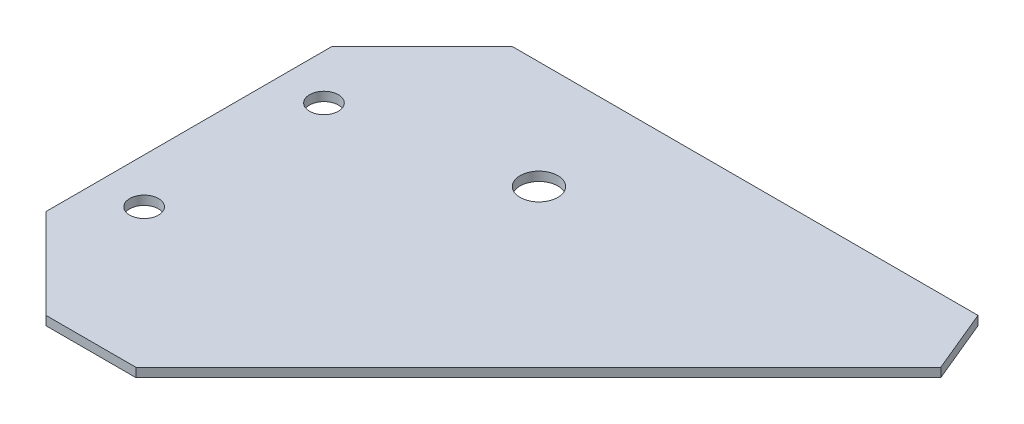
from build123d import *

# Parameters (mm, degrees)
SKETCH_1_W          = 80
SKETCH_1_H          = 31.819805153
SKETCH_1_H_2        = 20
EXTRUDE_1_DEPTH     = 1
CUT_EXTRUDE_1_DEPTH = 10
CHAMFER_1_SIZE      = 10
SKETCH_4_R          = 1.6
SKETCH_4_R_2        = 2.1
CUT_EXTRUDE_2_DEPTH = 10


with BuildPart() as part:
    # 草图1 → 凸台-拉伸1 (new body)
    with BuildSketch(Plane(origin=(0, 0, 0), x_dir=(1, 0, 0), z_dir=(0, 1, 0))):
        with Locations((40, 15.909902577)):
            Rectangle(SKETCH_1_W, SKETCH_1_H)
        with Locations((40, -10)):
            Rectangle(SKETCH_1_W, SKETCH_1_H_2)
    extrude(amount=EXTRUDE_1_DEPTH)

    # 草图3 → 切除-拉伸1 (cut)
    with BuildSketch(Plane(origin=(0, 1, 0), x_dir=(1, 0, 0), z_dir=(0, 1, 0))):
        Polygon((80, -20), (80, 40), (20, -20), align=None)
    extrude(amount=-CUT_EXTRUDE_1_DEPTH, mode=Mode.SUBTRACT)

    # 倒角1
    chamfer_1_edges = [part.edges().sort_by_distance(p)[0] for p in [
        (0, 0.5, 20),
        (71.819805153, 0.5, -31.819805153),
        (0, 0.5, -31.819805153),
    ]]
    chamfer(chamfer_1_edges, length=CHAMFER_1_SIZE)

    # 草图4 → 切除-拉伸2 (cut)
    with BuildSketch(Plane(origin=(0, 1, 0), x_dir=(1, 0, 0), z_dir=(0, 1, 0))):
        with Locations(Location((5, 15.909902577, 0), (0, 0, 270))):
            Circle(SKETCH_4_R)
        with Locations(Location((5, -4.090097423, 0), (0, 0, 270))):
            Circle(SKETCH_4_R)
        with Locations(Location((25, 19.819805153, 0), (0, 0, 270))):
            Circle(SKETCH_4_R_2)
    extrude(amount=-CUT_EXTRUDE_2_DEPTH, mode=Mode.SUBTRACT)


solid = part.part
